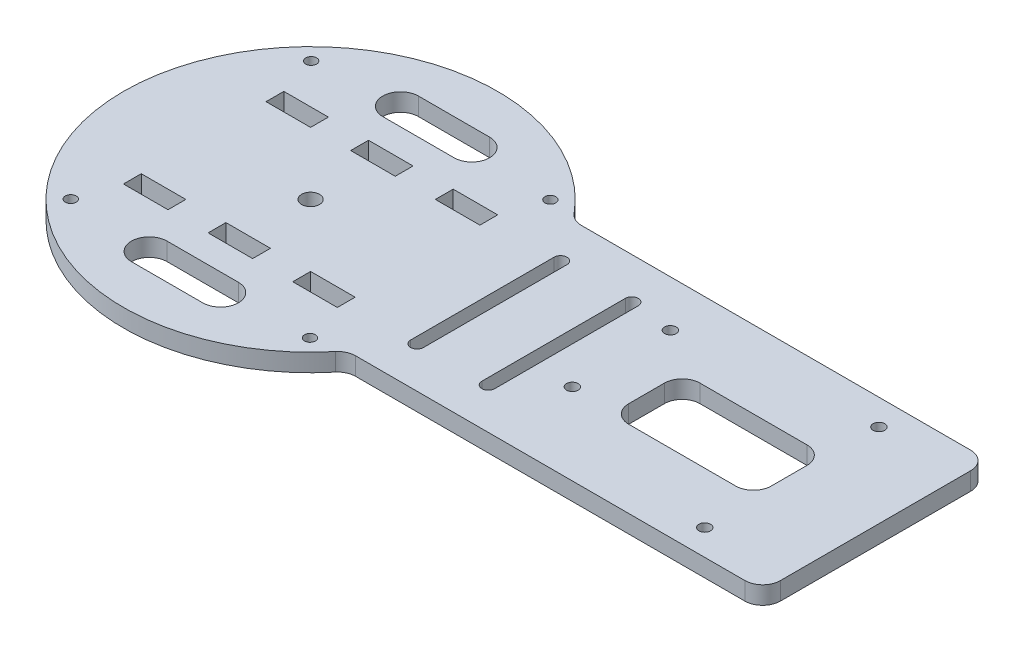
from build123d import *

# Parameters (mm, degrees)
SKETCH_1_R      = 1.525
SKETCH_1_R_2    = 2.5
SKETCH_1_R_3    = 1.625
SKETCH_1_W      = 12.5
SKETCH_1_H      = 5
SKETCH_1_W_2    = 40
SKETCH_1_H_2    = 20
EXTRUDE_1_DEPTH = 5
FILLET_1_R      = 5


with BuildPart() as part:
    # 草图1 → 凸台-拉伸1 (new body)
    with BuildSketch(Plane(origin=(0, 0, 0), x_dir=(1, 0, 0), z_dir=(0, 1, 0))):
        with BuildLine():
            Line((41.868178549, 31.675), (158.5, 31.675))
            Line((158.5, 31.675), (158.5, -31.675))
            Line((158.5, -31.675), (41.868178549, -31.675))
            ThreePointArc((41.868178549, -31.675), (-52.5, 0), (41.868178549, 31.675))
        make_face()
        with Locations(Location((-33.55358156, 33.720895004, 0), (0, 0, 270))):
            Circle(SKETCH_1_R, mode=Mode.SUBTRACT)
        with Locations(Location((0, 0, 0), (0, 0, 270))):
            Circle(SKETCH_1_R_2, mode=Mode.SUBTRACT)
        with Locations(Location((82.254, 18.675, 0), (0, 0, 270))):
            Circle(SKETCH_1_R_3, mode=Mode.SUBTRACT)
        with Locations(Location((82.254, -8.825, 0), (0, 0, 270))):
            Circle(SKETCH_1_R_3, mode=Mode.SUBTRACT)
        with Locations(Location((135, 24.425, 0), (0, 0, 270))):
            Circle(SKETCH_1_R_3, mode=Mode.SUBTRACT)
        with Locations(Location((135, -24.425, 0), (0, 0, 90))):
            Circle(SKETCH_1_R_3, mode=Mode.SUBTRACT)
        with Locations(Location((33.720895004, 33.55358156, 0), (0, 0, 270))):
            Circle(SKETCH_1_R, mode=Mode.SUBTRACT)
        with Locations(Location((33.55358156, -33.720895004, 0), (0, 0, 270))):
            Circle(SKETCH_1_R, mode=Mode.SUBTRACT)
        with Locations(Location((-33.720895004, -33.55358156, 0), (0, 0, 270))):
            Circle(SKETCH_1_R, mode=Mode.SUBTRACT)
        with Locations((23.75, -20)):
            Rectangle(SKETCH_1_W, SKETCH_1_H, mode=Mode.SUBTRACT)
        with Locations((-23.75, 20)):
            Rectangle(SKETCH_1_W, SKETCH_1_H, mode=Mode.SUBTRACT)
        with Locations((0, 20)):
            Rectangle(SKETCH_1_W, SKETCH_1_H, mode=Mode.SUBTRACT)
        with Locations((23.75, 20)):
            Rectangle(SKETCH_1_W, SKETCH_1_H, mode=Mode.SUBTRACT)
        with Locations((0, -20)):
            Rectangle(SKETCH_1_W, SKETCH_1_H, mode=Mode.SUBTRACT)
        with Locations((-23.75, -20)):
            Rectangle(SKETCH_1_W, SKETCH_1_H, mode=Mode.SUBTRACT)
        with BuildLine():
            Line((-10, -30.25), (10, -30.25))
            ThreePointArc((10, -30.25), (15, -35.25), (10, -40.25))
            Line((10, -40.25), (-10, -40.25))
            ThreePointArc((-10, -40.25), (-15, -35.25), (-10, -30.25))
        make_face(mode=Mode.SUBTRACT)
        with BuildLine():
            Line((-10, 40.25), (10, 40.25))
            ThreePointArc((10, 40.25), (15, 35.25), (10, 30.25))
            Line((10, 30.25), (-10, 30.25))
            ThreePointArc((-10, 30.25), (-15, 35.25), (-10, 40.25))
        make_face(mode=Mode.SUBTRACT)
        with BuildLine():
            Line((48.183761531, 20.125053296), (48.183761531, -20.125053296))
            ThreePointArc((48.183761531, -20.125053296), (50, -21.941291765), (51.816238469, -20.125053296))
            Line((51.816238469, -20.125053296), (51.816238469, 20.125053296))
            ThreePointArc((51.816238469, 20.125053296), (50, 21.941291765), (48.183761531, 20.125053296))
        make_face(mode=Mode.SUBTRACT)
        with BuildLine():
            Line((68.183761531, 20.125053296), (68.183761531, -20.125053296))
            ThreePointArc((68.183761531, -20.125053296), (70, -21.941291765), (71.816238469, -20.125053296))
            Line((71.816238469, -20.125053296), (71.816238469, 20.125053296))
            ThreePointArc((71.816238469, 20.125053296), (70, 21.941291765), (68.183761531, 20.125053296))
        make_face(mode=Mode.SUBTRACT)
        with Locations((114.25, 0)):
            Rectangle(SKETCH_1_W_2, SKETCH_1_H_2, mode=Mode.SUBTRACT)
    extrude(amount=EXTRUDE_1_DEPTH)

    # 圆角1
    fillet_1_edges = [part.edges().sort_by_distance(p)[0] for p in [
        (94.25, 2.5, -10),
        (94.25, 2.5, 10),
        (134.25, 2.5, 10),
        (134.25, 2.5, -10),
        (41.868178549, 2.5, -31.675),
        (158.5, 2.5, -31.675),
        (158.5, 2.5, 31.675),
        (41.868178549, 2.5, 31.675),
    ]]
    fillet(fillet_1_edges, radius=FILLET_1_R)


solid = part.part
